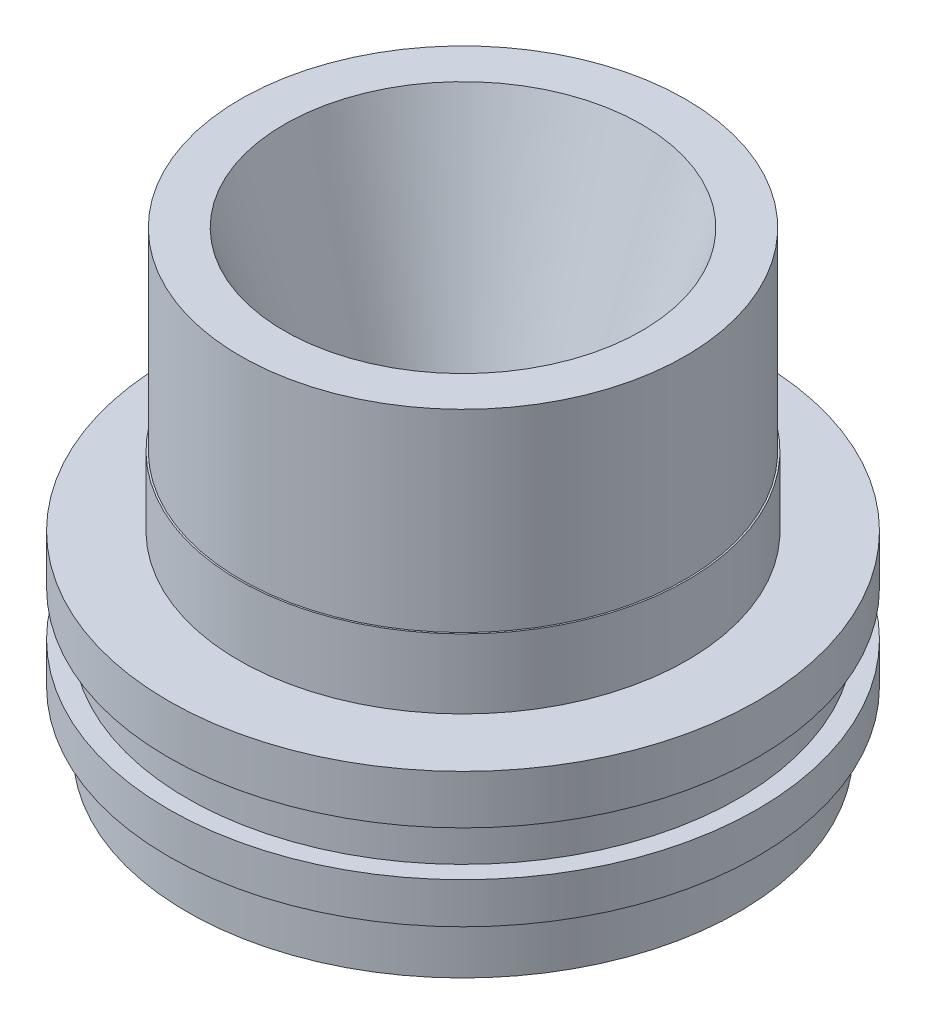
from build123d import *


with BuildPart() as part:
    # Sketch1 → Revolve1 (revolve)
    with BuildSketch(Plane.XY, mode=Mode.PRIVATE) as revolve1_sk:
        Polygon((-27.833802256, 12.902692784), (-13.589, -31.369507216), (-13.589, -44.069507216), (-40.513, -57.912507216), (-42.926, -57.912507216), (-42.926, -48.946307216), (-45.847, -48.946307216), (-45.847, -42.596307216), (-42.926, -42.596307216), (-42.926, -35.611307216), (-45.847, -35.611307216), (-45.847, -27.991307216), (-34.8996, -27.991307216), (-34.8996, -17.196307216), (-34.6456, -17.196307216), (-34.6456, 12.902692784), align=None)
    revolve(revolve1_sk.sketch.rotate(Axis((0, 0, 0), (0, 1, 0)), 270), axis=Axis((0, 0, 0), (0, 1, 0)))


solid = part.part
